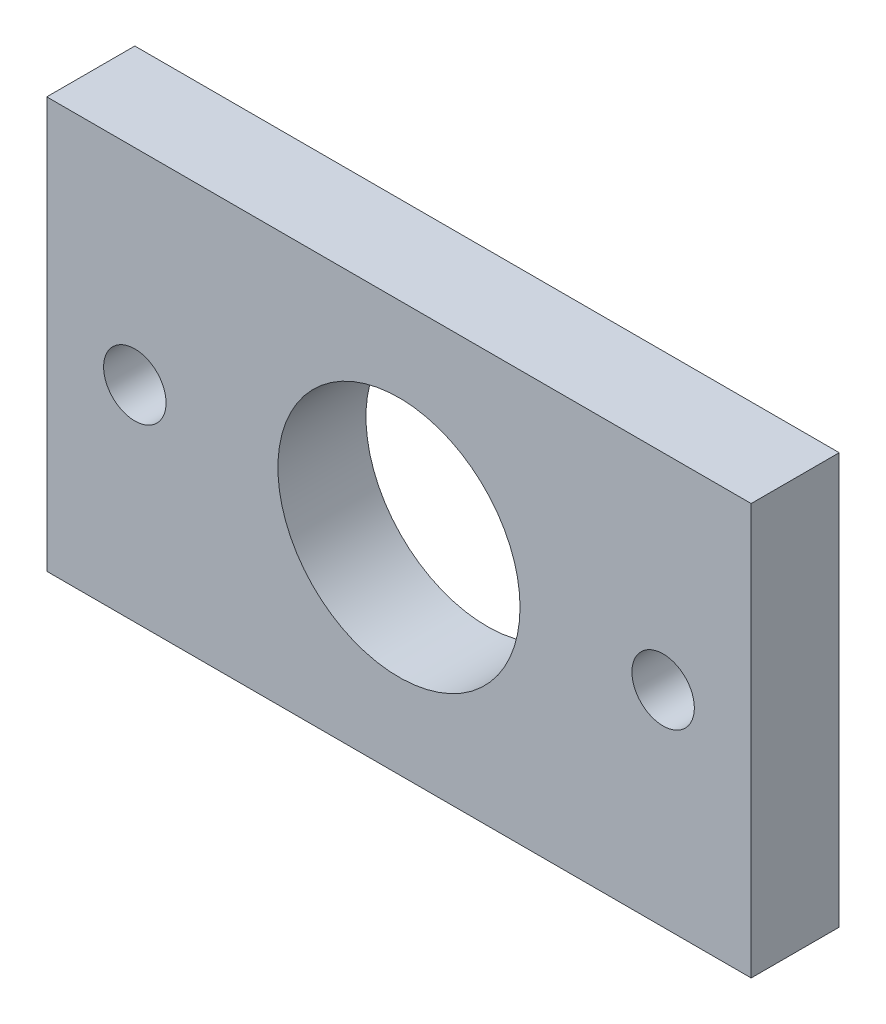
from build123d import *

# Parameters (mm, degrees)
SKETCH1_W               = 76.2
SKETCH1_H               = 44.45
BOSS_EXTRUDE1_DEPTH     = 9.525
F_1_CLEARANCE_HOLE1_D   = 26.19248
F_1_4_CLEARANCE_HOLE1_D = 6.7564


with BuildPart() as part:
    # Sketch1 → Boss-Extrude1 (new body)
    with BuildSketch(Plane.XY):
        Rectangle(SKETCH1_W, SKETCH1_H)
    extrude(amount=BOSS_EXTRUDE1_DEPTH)

    # 1 Clearance Hole1 (through all)
    with Locations(Plane.XY.offset(9.525)):
        with Locations((0, 0)):
            Hole(F_1_CLEARANCE_HOLE1_D / 2)

    # 1/4 Clearance Hole1 (through all)
    with Locations(Plane.XY.offset(9.525)):
        with Locations((-28.575, 0), (28.575, 0)):
            Hole(F_1_4_CLEARANCE_HOLE1_D / 2)


solid = part.part
